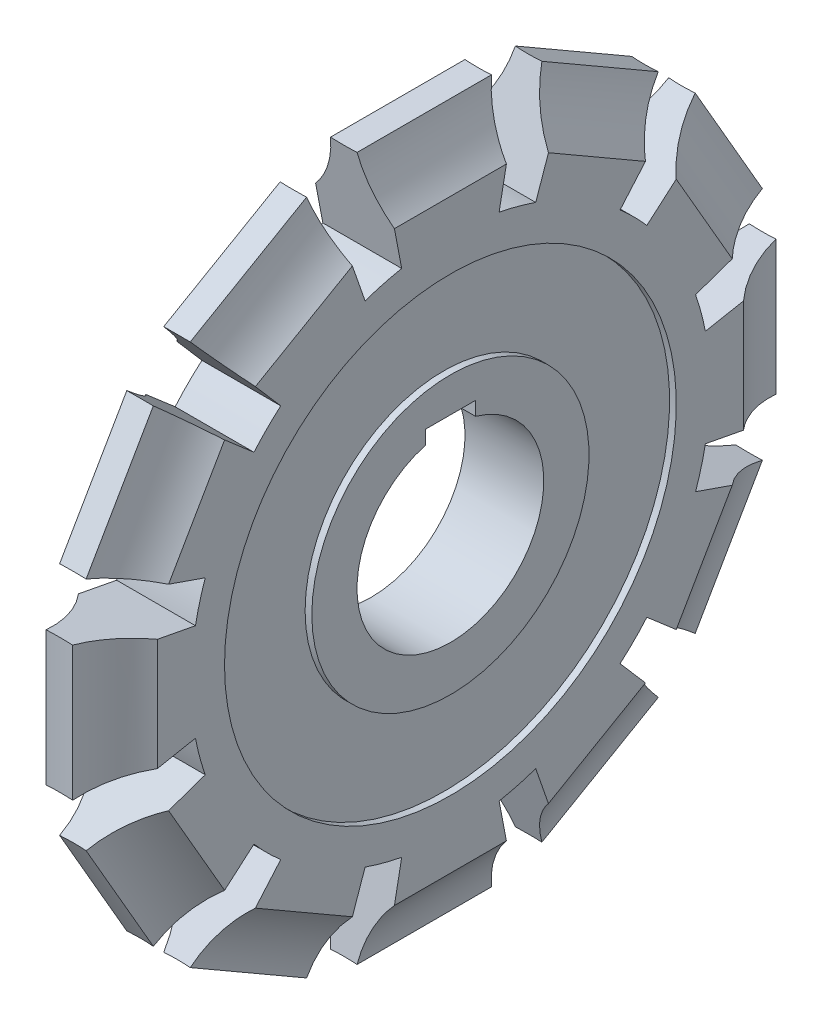
from build123d import *

# Parameters (mm, degrees)
BOSS_EXTRUDE1_DEPTH     = 5
CIRPATTERN1_COUNT       = 12
SKETCH4_R               = 16.811989879
SKETCH4_R_2             = 10.314619087
CUT_EXTRUDE1_DEPTH      = 0.5
SKETCH5_R               = 6.950731161
CUT_EXTRUDE2_DEPTH      = 46.5
CUT_EXTRUDE3_DEPTH      = 46.5
CIRPATTERN2_COUNT       = 12
CUT_EXTRUDE4_DEPTH      = 46.5
CUT_EXTRUDE4_DEPTH_BACK = 46.5
SKETCH10_W              = 3.744348286
SKETCH10_H              = 1.553508974


with BuildPart() as part:
    # Sketch1 → Boss-Extrude1 (new, symmetric)
    with BuildSketch(Plane.XY):
        with BuildLine():
            ThreePointArc((-0.986171591, 26.170075379), (-1.626916196, 23.842475136), (-2.932850173, 21.812004013))
            Line((-2.932850173, 21.812004013), (-2.932850173, -21.812004013))
            ThreePointArc((-2.932850173, -21.812004013), (-1.626916196, -23.842475136), (-0.986171591, -26.170075379))
            ThreePointArc((-0.986171591, -26.170075379), (0, -26.142264995), (0.986171591, -26.170075379))
            ThreePointArc((0.986171591, -26.170075379), (1.626916196, -23.842475136), (2.932850173, -21.812004013))
            Line((2.932850173, -21.812004013), (2.932850173, 21.812004013))
            ThreePointArc((2.932850173, 21.812004013), (1.626916196, 23.842475136), (0.986171591, 26.170075379))
            ThreePointArc((0.986171591, 26.170075379), (0, 26.142264995), (-0.986171591, 26.170075379))
        make_face()
    boss_extrude1 = extrude(amount=BOSS_EXTRUDE1_DEPTH, both=True)

    # CirPattern1: Boss-Extrude1 ×12 about axis
    cirpattern1_axis = Axis((-1000, 0, 0), (1, 0, 0))
    for i in range(1, CIRPATTERN1_COUNT):
        add(boss_extrude1.rotate(cirpattern1_axis, i * 360 / CIRPATTERN1_COUNT))

    # Sketch4 → Cut-Extrude1 (cut)
    with BuildSketch(Plane.ZY.offset(2.932850173)):
        Circle(SKETCH4_R)
        Circle(SKETCH4_R_2, mode=Mode.SUBTRACT)
    cut_extrude1 = extrude(amount=-CUT_EXTRUDE1_DEPTH, mode=Mode.SUBTRACT)

    # Sketch5 → Cut-Extrude2 (cut)
    with BuildSketch(Plane.ZY.offset(2.932850173)):
        Circle(SKETCH5_R)
    cut_extrude2 = extrude(amount=-CUT_EXTRUDE2_DEPTH, mode=Mode.SUBTRACT)

    # Sketch6 → Cut-Extrude3 (cut)
    with BuildSketch(Plane.ZY.offset(2.932850173)):
        with BuildLine():
            Line((-26.170075379, -5), (-18.975291906, -3.625379681))
            ThreePointArc((-18.975291906, -3.625379681), (-18.830320626, -4.315565534), (-18.660254038, -5))
            Line((-18.660254038, -5), (-26.170075379, -5))
        make_face()
        with BuildLine():
            Line((-26.170075379, 5), (-18.975291906, 3.625379681))
            ThreePointArc((-18.975291906, 3.625379681), (-18.830320626, 4.315565534), (-18.660254038, 5))
            Line((-18.660254038, 5), (-26.170075379, 5))
        make_face()
    cut_extrude3 = extrude(amount=-CUT_EXTRUDE3_DEPTH, mode=Mode.SUBTRACT)

    # CirPattern2: Cut-Extrude3 ×12 about axis
    cirpattern2_axis = Axis((-1000, 0, 0), (1, 0, 0))
    for i in range(1, CIRPATTERN2_COUNT):
        add(cut_extrude3.rotate(cirpattern2_axis, i * 360 / CIRPATTERN2_COUNT), mode=Mode.SUBTRACT)

    # Sketch10 → Cut-Extrude4 (cut, two sides: drawn at the far end of the back side and taken through both)
    with BuildSketch(Plane.ZY.offset(2.432850173).offset(-CUT_EXTRUDE4_DEPTH_BACK)):
        with Locations((0, 6.950731161)):
            Rectangle(SKETCH10_W, SKETCH10_H)
    extrude(amount=CUT_EXTRUDE4_DEPTH + CUT_EXTRUDE4_DEPTH_BACK, mode=Mode.SUBTRACT)

    # Mirror3: Cut-Extrude1, Cut-Extrude2 across plane
    add(cut_extrude1.mirror(Plane(origin=(0, 0, 0), x_dir=(0, 0, 1), z_dir=(1, 0, 0))), mode=Mode.SUBTRACT)
    add(cut_extrude2.mirror(Plane(origin=(0, 0, 0), x_dir=(0, 0, 1), z_dir=(1, 0, 0))), mode=Mode.SUBTRACT)


solid = part.part
